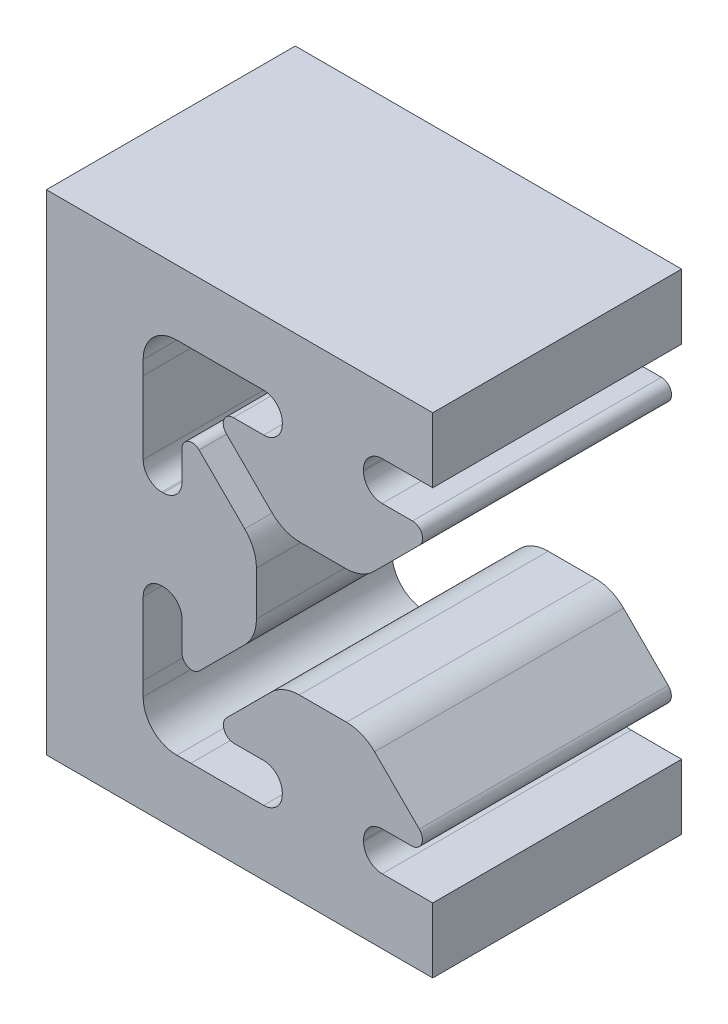
from build123d import *

# Parameters (mm, degrees)
BOSS_EXTRUDE1_DEPTH = 18
SKETCH2_R           = 1.75
CUT_EXTRUDE1_DEPTH  = 7


with BuildPart() as part:
    # Sketch1 → Boss-Extrude1 (new body)
    with BuildSketch(Plane.XY):
        with BuildLine():
            Line((7.941784918, -13), (7.941784918, -17.7))
            Line((7.941784918, -17.7), (-20, -17.7))
            Line((-20, -17.7), (-20, 17.699847501))
            Line((-20, 17.699847501), (7.941784918, 17.699847501))
            Line((7.941784918, 17.699847501), (7.941784918, 13))
            Line((7.941784918, 13), (6.333126718, 13))
            Line((6.333126718, 13), (5.317126718, 13))
            Line((5.317126718, 13), (4.287512407, 13))
            ThreePointArc((4.287512407, 13), (3.333616586, 12.604883414), (2.9385, 11.650987593))
            Line((2.9385, 11.650987593), (2.9385, 11.539212407))
            ThreePointArc((2.9385, 11.539212407), (3.333616586, 10.585316586), (4.287512407, 10.1902))
            Line((4.287512407, 10.1902), (6.476788598, 10.1902))
            ThreePointArc((6.476788598, 10.1902), (7.154992901, 9.736757749), (6.995146796, 8.93674514))
            Line((6.995146796, 8.93674514), (3.686383353, 5.635543623))
            ThreePointArc((3.686383353, 5.635543623), (2.754473742, 5.014017446), (1.655778399, 4.7958))
            Line((1.655778399, 4.7958), (-1.655778399, 4.7958))
            ThreePointArc((-1.655778399, 4.7958), (-2.754473742, 5.014017446), (-3.686383353, 5.635543623))
            Line((-3.686383353, 5.635543623), (-6.995146796, 8.93674514))
            ThreePointArc((-6.995146796, 8.93674514), (-7.154992901, 9.736757749), (-6.476788598, 10.1902))
            Line((-6.476788598, 10.1902), (-4.287512407, 10.1902))
            ThreePointArc((-4.287512407, 10.1902), (-3.333616586, 10.585316586), (-2.9385, 11.539212407))
            Line((-2.9385, 11.539212407), (-2.9385, 11.650987593))
            ThreePointArc((-2.9385, 11.650987593), (-3.333616586, 12.604883414), (-4.287512407, 13))
            Line((-4.287512407, 13), (-5.317126718, 13))
            Line((-5.317126718, 13), (-6.333126718, 13))
            Line((-6.333126718, 13), (-9.550465633, 13))
            Line((-9.550465633, 13), (-10.564722121, 12.999847763))
            ThreePointArc((-10.564722121, 12.999847763), (-12.294654751, 12.29465435), (-12.999847757, 10.564721553))
            Line((-12.999847757, 10.564721553), (-13, 9.550422515))
            Line((-13, 9.550422515), (-13, 5.3170836))
            Line((-13, 5.3170836), (-13, 4.287469289))
            ThreePointArc((-13, 4.287469289), (-12.604883414, 3.333573468), (-11.650987593, 2.938456882))
            Line((-11.650987593, 2.938456882), (-11.539212407, 2.938456882))
            ThreePointArc((-11.539212407, 2.938456882), (-10.585316586, 3.333573468), (-10.1902, 4.287469289))
            Line((-10.1902, 4.287469289), (-10.1902, 6.402089023))
            ThreePointArc((-10.1902, 6.402089023), (-9.74154152, 7.073969797), (-8.94902056, 6.917034355))
            Line((-8.94902056, 6.917034355), (-5.652895046, 3.628441884))
            ThreePointArc((-5.652895046, 3.628441884), (-5.027976112, 2.694919539), (-4.8085, 1.593185507))
            Line((-4.8085, 1.593185507), (-4.8085, -1.593185507))
            ThreePointArc((-4.8085, -1.593185507), (-5.027976112, -2.694919539), (-5.652895046, -3.628441884))
            Line((-5.652895046, -3.628441884), (-8.94902056, -6.917034355))
            ThreePointArc((-8.94902056, -6.917034355), (-9.74154152, -7.073969797), (-10.1902, -6.402089023))
            Line((-10.1902, -6.402089023), (-10.1902, -4.287469289))
            ThreePointArc((-10.1902, -4.287469289), (-10.585316586, -3.333573468), (-11.539212407, -2.938456882))
            Line((-11.539212407, -2.938456882), (-11.650987593, -2.938456882))
            ThreePointArc((-11.650987593, -2.938456882), (-12.604883414, -3.333573468), (-13, -4.287469289))
            Line((-13, -4.287469289), (-13, -5.3170836))
            Line((-13, -5.3170836), (-13, -6.3330836))
            Line((-13, -6.3330836), (-13, -9.550422515))
            Line((-13, -9.550422515), (-12.999847757, -10.564721553))
            ThreePointArc((-12.999847757, -10.564721553), (-12.294654751, -12.29465435), (-10.564722121, -12.999847763))
            Line((-10.564722121, -12.999847763), (-9.550465633, -13))
            Line((-9.550465633, -13), (-6.333126718, -13))
            Line((-6.333126718, -13), (-5.317126718, -13))
            Line((-5.317126718, -13), (-4.287512407, -13))
            ThreePointArc((-4.287512407, -13), (-3.333616586, -12.604883414), (-2.9385, -11.650987593))
            Line((-2.9385, -11.650987593), (-2.9385, -11.539212407))
            ThreePointArc((-2.9385, -11.539212407), (-3.333616586, -10.585316586), (-4.287512407, -10.1902))
            Line((-4.287512407, -10.1902), (-6.416408329, -10.1902))
            ThreePointArc((-6.416408329, -10.1902), (-7.137514675, -9.708134418), (-6.967711912, -8.857517813))
            Line((-6.967711912, -8.857517813), (-3.740331666, -5.636015806))
            ThreePointArc((-3.740331666, -5.636015806), (-2.808257752, -5.01414519), (-1.709253557, -4.7958))
            Line((-1.709253557, -4.7958), (1.709253557, -4.7958))
            ThreePointArc((1.709253557, -4.7958), (2.808257752, -5.01414519), (3.740331666, -5.636015806))
            Line((3.740331666, -5.636015806), (6.967711912, -8.857517813))
            ThreePointArc((6.967711912, -8.857517813), (7.137514675, -9.708134418), (6.416408329, -10.1902))
            Line((6.416408329, -10.1902), (4.287512407, -10.1902))
            ThreePointArc((4.287512407, -10.1902), (3.333616586, -10.585316586), (2.9385, -11.539212407))
            Line((2.9385, -11.539212407), (2.9385, -11.650987593))
            ThreePointArc((2.9385, -11.650987593), (3.333616586, -12.604883414), (4.287512407, -13))
            Line((4.287512407, -13), (5.317126718, -13))
            Line((5.317126718, -13), (6.333126718, -13))
            Line((6.333126718, -13), (7.941784918, -13))
        make_face()
    extrude(amount=BOSS_EXTRUDE1_DEPTH)

    # Sketch2 → Cut-Extrude1 (cut)
    with BuildSketch(Plane.ZY.offset(20)):
        with Locations((5.25, -0.7)):
            Circle(SKETCH2_R)
        with Locations((12.75, -0.7)):
            Circle(SKETCH2_R)
        with Locations((5.25, -6.7)):
            Circle(SKETCH2_R)
        with Locations((12.75, -6.7)):
            Circle(SKETCH2_R)
    extrude(amount=-CUT_EXTRUDE1_DEPTH, mode=Mode.SUBTRACT)


solid = part.part
